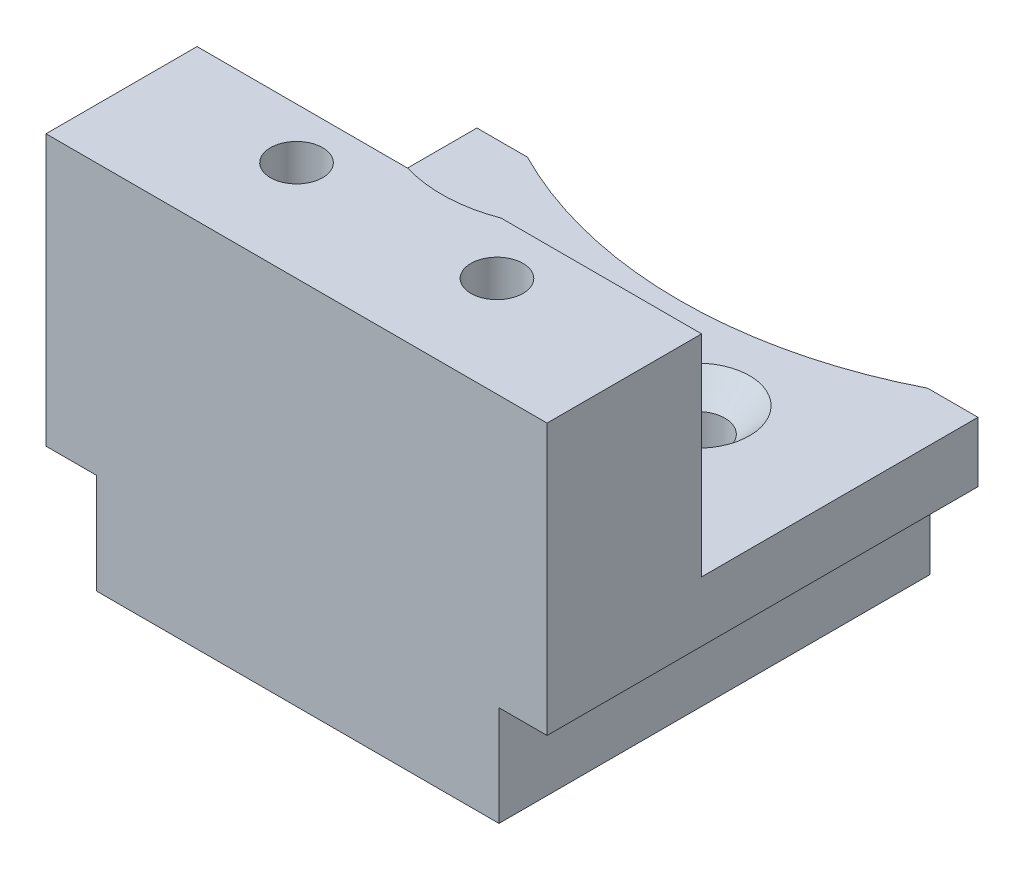
from build123d import *

# Parameters (mm, degrees)
SKETCH1_R                                       = 2.6
BOSS_EXTRUDE1_DEPTH                             = 6
SKETCH2_R                                       = 3.25
BOSS_EXTRUDE2_DEPTH                             = 2
SKETCH3_R                                       = 2.5
BOSS_EXTRUDE3_DEPTH                             = 2.7
CSK_FOR_M5_FLAT_HEAD_MACHINE_SCREW1_D           = 5.5
CSK_FOR_M5_FLAT_HEAD_MACHINE_SCREW1_CSINK_D     = 10.4
CSK_FOR_M5_FLAT_HEAD_MACHINE_SCREW1_CSINK_ANGLE = 90
SKETCH7_R                                       = 2.6
BOSS_EXTRUDE5_DEPTH                             = 21
SKETCH8_W                                       = 43
SKETCH8_H                                       = 10
BOSS_EXTRUDE6_DEPTH                             = 50
SKETCH9_W                                       = 4.8
SKETCH9_H                                       = 10
SKETCH9_W_2                                     = 5.031184409
CUT_EXTRUDE1_DEPTH                              = 50


with BuildPart() as part:
    # Sketch1 → Boss-Extrude1 (new body)
    with BuildSketch(Plane(origin=(0, 0, 0), x_dir=(1, 0, 0), z_dir=(0, 1, 0))):
        with BuildLine():
            Line((5.031184409, -3), (0, -3))
            Line((0, -3), (0, -46))
            Line((0, -46), (50, -46))
            Line((50, -46), (50, -3))
            Line((50, -3), (44.968815591, -3))
            ThreePointArc((44.968815591, -3), (25, -7.79226602), (5.031184409, -3))
        make_face()
        with Locations(Location((15, -36, 0), (0, 0, 270))):
            Circle(SKETCH1_R, mode=Mode.SUBTRACT)
        with Locations(Location((35, -36, 0), (0, 0, 270))):
            Circle(SKETCH1_R, mode=Mode.SUBTRACT)
        with Locations(Location((15, -16, 0), (0, 0, 270))):
            Circle(SKETCH1_R, mode=Mode.SUBTRACT)
        with Locations(Location((35, -16, 0), (0, 0, 270))):
            Circle(SKETCH1_R, mode=Mode.SUBTRACT)
    extrude(amount=BOSS_EXTRUDE1_DEPTH)

    # Sketch2 → Boss-Extrude2 (add)
    with BuildSketch(Plane(origin=(0, 6, 0), x_dir=(1, 0, 0), z_dir=(0, 1, 0))):
        with Locations(Location((25, -17.5, 0), (0, 0, 270))):
            Circle(SKETCH2_R)
    extrude(amount=BOSS_EXTRUDE2_DEPTH)

    # Sketch3 → Boss-Extrude3 (add)
    with BuildSketch(Plane(origin=(0, 8, 0), x_dir=(1, 0, 0), z_dir=(0, 1, 0))):
        with Locations(Location((25, -17.5, 0), (0, 0, 90))):
            Circle(SKETCH3_R)
    extrude(amount=BOSS_EXTRUDE3_DEPTH)

    # CSK for M5 Flat Head Machine Screw1 (through all)
    with Locations(Plane(origin=(0, 6, 0), x_dir=(1, 0, 0), z_dir=(0, 1, 0))):
        with Locations((15, -16), (35, -16)):
            CounterSinkHole(CSK_FOR_M5_FLAT_HEAD_MACHINE_SCREW1_D / 2, CSK_FOR_M5_FLAT_HEAD_MACHINE_SCREW1_CSINK_D / 2, counter_sink_angle=CSK_FOR_M5_FLAT_HEAD_MACHINE_SCREW1_CSINK_ANGLE)

    # Sketch7 → Boss-Extrude5 (add)
    with BuildSketch(Plane(origin=(0, 6, 0), x_dir=(1, 0, 0), z_dir=(0, 1, 0))):
        with BuildLine():
            Line((21.039948447, -30.928253487), (0, -30.928253487))
            Line((0, -30.928253487), (0, -46))
            Line((0, -46), (50, -46))
            Line((50, -46), (50, -30.580877922))
            Line((50, -30.580877922), (29.989051292, -30.580877922))
            ThreePointArc((29.989051292, -30.580877922), (25.543026299, -31.489464694), (21.039948447, -30.928253487))
        make_face()
        with Locations(Location((15, -36, 0), (0, 0, 270))):
            Circle(SKETCH7_R, mode=Mode.SUBTRACT)
        with Locations(Location((35, -36, 0), (0, 0, 270))):
            Circle(SKETCH7_R, mode=Mode.SUBTRACT)
    extrude(amount=BOSS_EXTRUDE5_DEPTH)

    # Sketch8 → Boss-Extrude6 (add)
    with BuildSketch(Plane.ZY):
        with Locations((24.5, -5)):
            Rectangle(SKETCH8_W, SKETCH8_H)
    extrude(amount=-BOSS_EXTRUDE6_DEPTH)

    # Sketch9 → Cut-Extrude1 (cut)
    with BuildSketch(Plane(origin=(0, 0, 3), x_dir=(-1, 0, 0), z_dir=(0, 0, -1))):
        with Locations((-47.6, -5)):
            Rectangle(SKETCH9_W, SKETCH9_H)
        with Locations((-2.515592205, -5)):
            Rectangle(SKETCH9_W_2, SKETCH9_H)
    extrude(amount=-CUT_EXTRUDE1_DEPTH, mode=Mode.SUBTRACT)


solid = part.part
